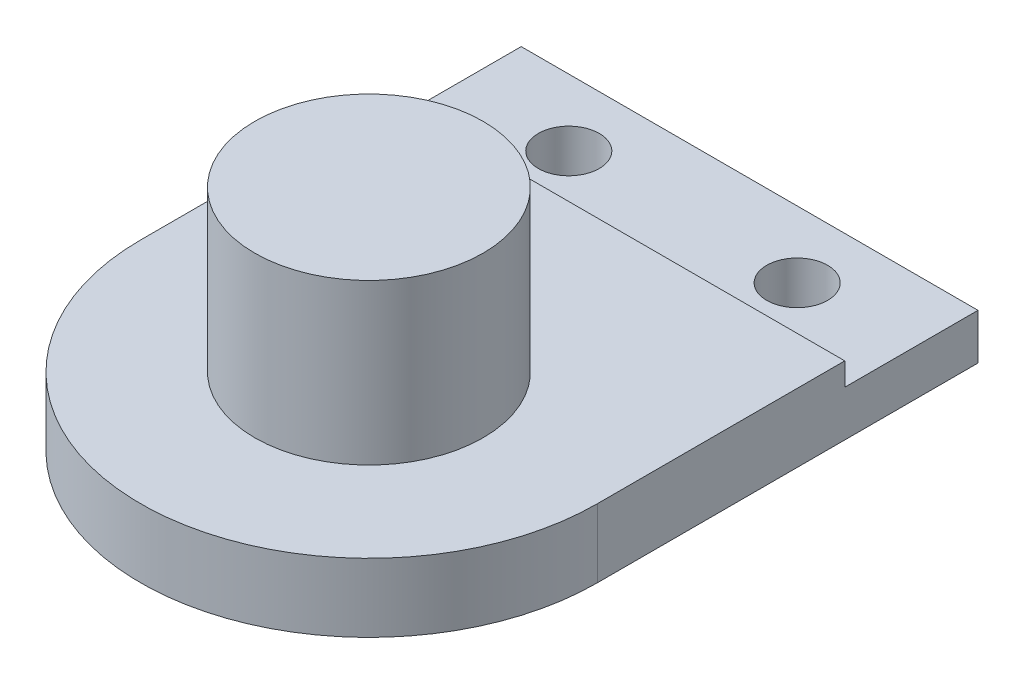
from build123d import *

# Parameters (mm, degrees)
BOSS_EXTRUDE1_DEPTH = 1.8
SKETCH2_W           = 12
SKETCH2_H           = 3.5
CUT_EXTRUDE1_DEPTH  = 0.6
SKETCH3_R           = 3
BOSS_EXTRUDE2_DEPTH = 4.2
SKETCH4_R           = 0.8
CUT_EXTRUDE2_DEPTH  = 15.920922753


with BuildPart() as part:
    # Sketch1 → Boss-Extrude1 (new body)
    with BuildSketch(Plane(origin=(0, 0, 0), x_dir=(1, 0, 0), z_dir=(0, 1, 0))):
        with BuildLine():
            Line((-3.465517241, 4.74137931), (8.534482759, 4.74137931))
            Line((8.534482759, 4.74137931), (8.534482759, -5.25862069))
            ThreePointArc((8.534482759, -5.25862069), (2.534482759, -11.25862069), (-3.465517241, -5.25862069))
            Line((-3.465517241, -5.25862069), (-3.465517241, 4.74137931))
        make_face()
    extrude(amount=BOSS_EXTRUDE1_DEPTH)

    # Sketch2 → Cut-Extrude1 (cut)
    with BuildSketch(Plane(origin=(0, 1.8, 0), x_dir=(1, 0, 0), z_dir=(0, 1, 0))):
        with Locations((2.534482759, 2.99137931)):
            Rectangle(SKETCH2_W, SKETCH2_H)
    extrude(amount=-CUT_EXTRUDE1_DEPTH, mode=Mode.SUBTRACT)

    # Sketch3 → Boss-Extrude2 (add)
    with BuildSketch(Plane(origin=(0, 1.8, 0), x_dir=(1, 0, 0), z_dir=(0, 1, 0))):
        with Locations(Location((2.534482759, -5.25862069, 0), (0, 0, 270))):
            Circle(SKETCH3_R)
    extrude(amount=BOSS_EXTRUDE2_DEPTH)

    # Sketch4 → Cut-Extrude2 (cut, through all)
    with BuildSketch(Plane(origin=(0, 1.2, 0), x_dir=(1, 0, 0), z_dir=(0, 1, 0))):
        with Locations(Location((5.534482759, 2.99137931, 0), (0, 0, 270))):
            Circle(SKETCH4_R)
        with Locations(Location((-0.465517241, 2.99137931, 0), (0, 0, 90))):
            Circle(SKETCH4_R)
    extrude(amount=-CUT_EXTRUDE2_DEPTH, mode=Mode.SUBTRACT)


solid = part.part
